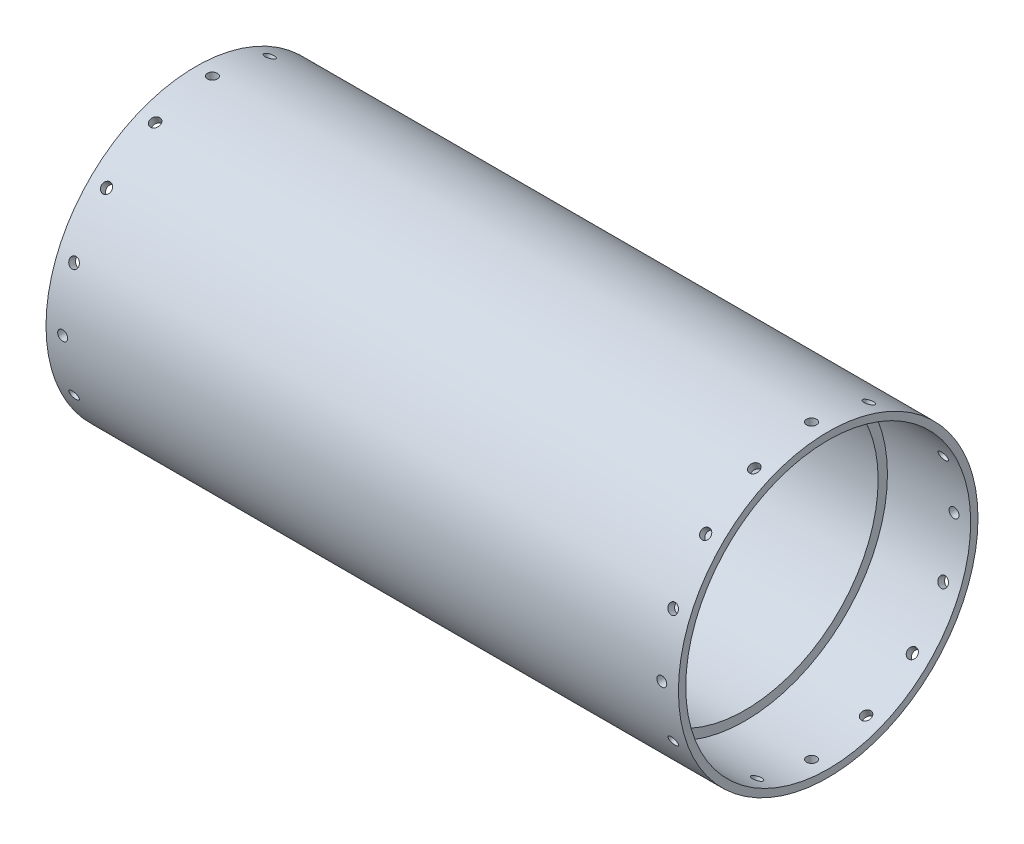
from build123d import *

# Parameters (mm, degrees)
SKETCH1_R                  = 57.15
SKETCH1_R_2                = 50.8
BOSS_EXTRUDE1_DEPTH        = 241.3
F_6_CLEARANCE_HOLE1_REACH  = 269.455
F_6_CLEARANCE_HOLE1_BORE_R = 1.89865
CIRPATTERN1_COUNT          = 16
SKETCH5_R                  = 54.356
CUT_EXTRUDE1_DEPTH         = 31.75
CUT_EXTRUDE2_START         = -31.75
SKETCH6_R                  = 54.356
CUT_EXTRUDE2_DEPTH         = 31.75


with BuildPart() as part:
    # Sketch1 → Boss-Extrude1 (new body)
    with BuildSketch(Plane(origin=(0, 0, 0), x_dir=(0, 0, -1), z_dir=(1, 0, 0))):
        with Locations(Location((0, 0, 0), (0, 0, 180))):
            Circle(SKETCH1_R)
        with Locations(Location((0, 0, 0), (0, 0, 180))):
            Circle(SKETCH1_R_2, mode=Mode.SUBTRACT)
    extrude(amount=BOSS_EXTRUDE1_DEPTH)

    # #6 Clearance Hole1 bore (on position points) → #6 Clearance Hole1 (cut, up to next)
    with BuildSketch(Plane(origin=(6.35, 57.15, 0), x_dir=(1, 0, 0), z_dir=(0, 1, 0)), mode=Mode.PRIVATE) as f_6_clearance_hole1_sk1:
        Circle(F_6_CLEARANCE_HOLE1_BORE_R)
    f_6_clearance_hole1_tool1 = extrude(f_6_clearance_hole1_sk1.sketch, amount=-F_6_CLEARANCE_HOLE1_REACH, mode=Mode.PRIVATE) & part.part
    # #6 Clearance Hole1 bore (on position points) → #6 Clearance Hole1 (cut, up to next)
    with BuildSketch(Plane(origin=(6.35, 57.15, 0), x_dir=(1, 0, 0), z_dir=(0, 1, 0)), mode=Mode.PRIVATE) as f_6_clearance_hole1_sk2:
        with Locations((228.6, 0)):
            Circle(F_6_CLEARANCE_HOLE1_BORE_R)
    f_6_clearance_hole1_tool2 = extrude(f_6_clearance_hole1_sk2.sketch, amount=-F_6_CLEARANCE_HOLE1_REACH, mode=Mode.PRIVATE) & part.part
    f_6_clearance_hole1_1 = f_6_clearance_hole1_tool1.solids().sort_by_distance((6.35, 57.15, 0))[0]
    add(f_6_clearance_hole1_1, mode=Mode.SUBTRACT)
    f_6_clearance_hole1_2 = f_6_clearance_hole1_tool2.solids().sort_by_distance((234.95, 57.15, 0))[0]
    add(f_6_clearance_hole1_2, mode=Mode.SUBTRACT)
    f_6_clearance_hole1 = f_6_clearance_hole1_1 + f_6_clearance_hole1_2  # #6 Clearance Hole1 as one shape, for the pattern or mirror that repeats it

    # CirPattern1: #6 Clearance Hole1 ×16 about axis
    cirpattern1_axis = Axis((241.3, 0, 0), (-1, 0, 0))
    for i in range(1, CIRPATTERN1_COUNT):
        add(f_6_clearance_hole1.rotate(cirpattern1_axis, i * 360 / CIRPATTERN1_COUNT), mode=Mode.SUBTRACT)

    # Sketch5 → Cut-Extrude1 (cut)
    with BuildSketch(Plane(origin=(241.3, 0, 0), x_dir=(0, 0, -1), z_dir=(1, 0, 0))):
        Circle(SKETCH5_R)
    extrude(amount=-CUT_EXTRUDE1_DEPTH, mode=Mode.SUBTRACT)

    # Sketch6 → Cut-Extrude2 (cut)
    with BuildSketch(Plane.ZY.offset(CUT_EXTRUDE2_START)):
        with Locations(Location((0, 0, 0), (0, 0, 180))):
            Circle(SKETCH6_R)
    extrude(amount=CUT_EXTRUDE2_DEPTH, mode=Mode.SUBTRACT)


solid = part.part
